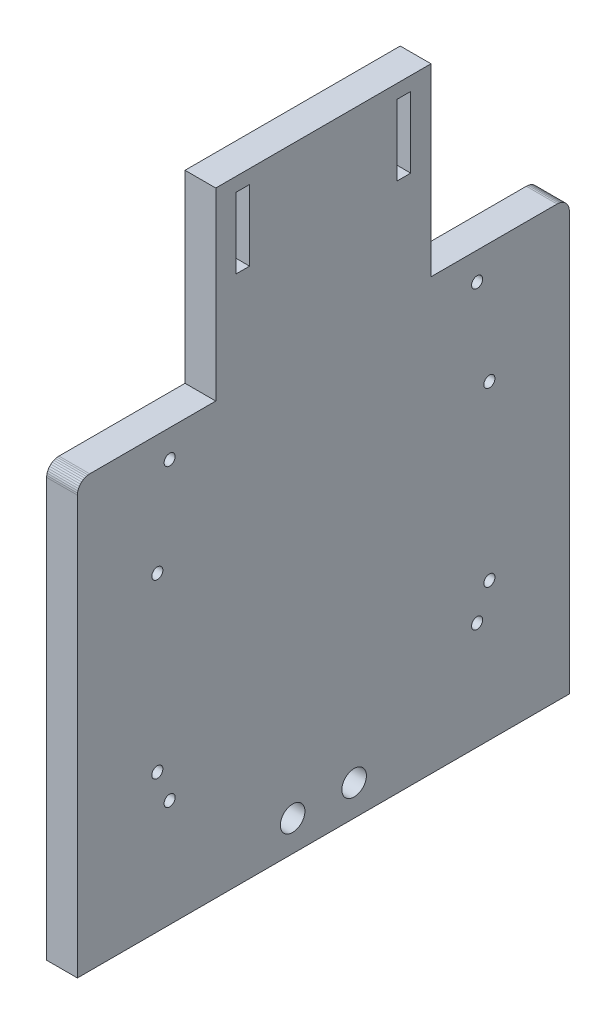
from build123d import *

# Parameters (mm, degrees)
BOSS_EXTRUDE1_DEPTH = 5.000002682
SKETCH2_R           = 2.000000134
CUT_EXTRUDE1_DEPTH  = 251.578832691
SKETCH3_R           = 2.000006516
CUT_EXTRUDE2_DEPTH  = 251.578832691
SKETCH4_R           = 0.899997723
CUT_EXTRUDE3_DEPTH  = 2.999998629
SKETCH5_R           = 0.899983627
CUT_EXTRUDE4_DEPTH  = 3.00000608
SKETCH6_R           = 0.900000334
CUT_EXTRUDE5_DEPTH  = 3.00000608
SKETCH7_R           = 0.899990272
CUT_EXTRUDE6_DEPTH  = 2.999998629
SKETCH8_R           = 0.899993205
CUT_EXTRUDE7_DEPTH  = 3.00000608
SKETCH9_R           = 0.899993205
CUT_EXTRUDE8_DEPTH  = 3.00000608
SKETCH10_R          = 0.899997723
CUT_EXTRUDE9_DEPTH  = 2.999998629
SKETCH11_R          = 0.899993205
CUT_EXTRUDE10_DEPTH = 2.999998629
SKETCH12_W          = 2.2
SKETCH12_H          = 11.5
BOSS_EXTRUDE2_DEPTH = 5


with BuildPart() as part:
    # Sketch1 → Boss-Extrude1 (new body)
    with BuildSketch(Plane(origin=(-115.112178028, 0, 0), x_dir=(0, -1, 0), z_dir=(-1, 0, 0))):
        Polygon((-142.581447959, 52.566498518), (-142.581447959, 132.56649673), (-210.581451654, 132.56649673), (-210.866093636, 132.546141744), (-211.144909263, 132.485494018), (-211.412280798, 132.385760546), (-211.662739515, 132.249012589), (-211.891174316, 132.078006864), (-212.09295094, 131.876215339), (-212.263956666, 131.647780538), (-212.400704622, 131.39732182), (-212.500438094, 131.129965186), (-212.561100721, 130.851134658), (-212.581455708, 130.566492677), (-212.581455708, 54.566498846), (-212.561100721, 54.281868041), (-212.500438094, 54.003033787), (-212.400704622, 53.735669702), (-212.263956666, 53.485218436), (-212.09295094, 53.256779909), (-211.891174316, 53.05499956), (-211.662739515, 52.883990109), (-211.412280798, 52.747234702), (-211.144909263, 52.647516131), (-210.866093636, 52.586857229), (-210.581451654, 52.566498518), align=None)
    extrude(amount=-BOSS_EXTRUDE1_DEPTH)

    # Sketch2 → Cut-Extrude1 (cut, through all)
    with BuildSketch(Plane.ZY.offset(115.112178028)):
        with Locations((97.566500306, 147.581450641)):
            Circle(SKETCH2_R)
    extrude(amount=-CUT_EXTRUDE1_DEPTH, mode=Mode.SUBTRACT)

    # Sketch3 → Cut-Extrude2 (cut, through all)
    with BuildSketch(Plane(origin=(-110.112175345, 0, 0), x_dir=(0, 0, -1), z_dir=(1, 0, 0))):
        with Locations((-87.566494942, 147.581450641)):
            Circle(SKETCH3_R)
    extrude(amount=-CUT_EXTRUDE2_DEPTH, mode=Mode.SUBTRACT)

    # Sketch4 → Cut-Extrude3 (cut)
    with BuildSketch(Plane(origin=(-110.112175345, 0, 0), x_dir=(0, 0, -1), z_dir=(1, 0, 0))):
        with Locations((-119.566500187, 165.081456304)):
            Circle(SKETCH4_R)
    cut_extrude3 = extrude(amount=-CUT_EXTRUDE3_DEPTH, mode=Mode.SUBTRACT)

    # Sketch5 → Cut-Extrude4 (cut)
    with BuildSketch(Plane.ZY.offset(115.112178028)):
        with Locations((125.066503882, 160.081461072)):
            Circle(SKETCH5_R)
    extrude(amount=-CUT_EXTRUDE4_DEPTH, mode=Mode.SUBTRACT)

    # Sketch6 → Cut-Extrude5 (cut)
    with BuildSketch(Plane.ZY.offset(115.112178028)):
        with Locations((60.066498816, 160.081461072)):
            Circle(SKETCH6_R)
    extrude(amount=-CUT_EXTRUDE5_DEPTH, mode=Mode.SUBTRACT)

    # Sketch7 → Cut-Extrude6 (cut)
    with BuildSketch(Plane(origin=(-110.112175345, 0, 0), x_dir=(0, 0, -1), z_dir=(1, 0, 0))):
        with Locations((-67.566499114, 160.081461072)):
            Circle(SKETCH7_R)
    cut_extrude6 = extrude(amount=-CUT_EXTRUDE6_DEPTH, mode=Mode.SUBTRACT)

    # Sketch8 → Cut-Extrude7 (cut)
    with BuildSketch(Plane.ZY.offset(115.112178028)):
        with Locations((125.066503882, 205.08146286)):
            Circle(SKETCH8_R)
    extrude(amount=-CUT_EXTRUDE7_DEPTH, mode=Mode.SUBTRACT)

    # Sketch9 → Cut-Extrude8 (cut)
    with BuildSketch(Plane.ZY.offset(115.112178028)):
        with Locations((60.066498816, 205.08146286)):
            Circle(SKETCH9_R)
    extrude(amount=-CUT_EXTRUDE8_DEPTH, mode=Mode.SUBTRACT)

    # Sketch10 → Cut-Extrude9 (cut)
    with BuildSketch(Plane(origin=(-110.112175345, 0, 0), x_dir=(0, 0, -1), z_dir=(1, 0, 0))):
        with Locations((-119.566500187, 193.081453443)):
            Circle(SKETCH10_R)
    cut_extrude9 = extrude(amount=-CUT_EXTRUDE9_DEPTH, mode=Mode.SUBTRACT)

    # Sketch11 → Cut-Extrude10 (cut)
    with BuildSketch(Plane(origin=(-110.112175345, 0, 0), x_dir=(0, 0, -1), z_dir=(1, 0, 0))):
        with Locations((-67.566499114, 208.081454039)):
            Circle(SKETCH11_R)
    cut_extrude10 = extrude(amount=-CUT_EXTRUDE10_DEPTH, mode=Mode.SUBTRACT)

    # Sketch12 → Boss-Extrude2 (add)
    with BuildSketch(Plane(origin=(-110.112175345, 0, 0), x_dir=(0, 0, -1), z_dir=(1, 0, 0))):
        Polygon((-110.066497624, 226.581455708), (-110.066497624, 212.581455708), (-75.066497624, 212.581455708), (-75.066497624, 226.581455708), (-75.066497624, 242.581455708), (-110.066497624, 242.581455708), align=None)
        with Locations((-105.666497624, 234.581455708)):
            Rectangle(SKETCH12_W, SKETCH12_H, mode=Mode.SUBTRACT)
        with Locations((-79.466497624, 234.581455708)):
            Rectangle(SKETCH12_W, SKETCH12_H, mode=Mode.SUBTRACT)
    extrude(amount=-BOSS_EXTRUDE2_DEPTH)

    # Mirror1: Cut-Extrude3, Cut-Extrude6, Cut-Extrude9, Cut-Extrude10 across plane
    add(cut_extrude3.mirror(Plane.XY.offset(92.566497624)), mode=Mode.SUBTRACT)
    add(cut_extrude6.mirror(Plane.XY.offset(92.566497624)), mode=Mode.SUBTRACT)
    add(cut_extrude9.mirror(Plane.XY.offset(92.566497624)), mode=Mode.SUBTRACT)
    add(cut_extrude10.mirror(Plane.XY.offset(92.566497624)), mode=Mode.SUBTRACT)


solid = part.part
